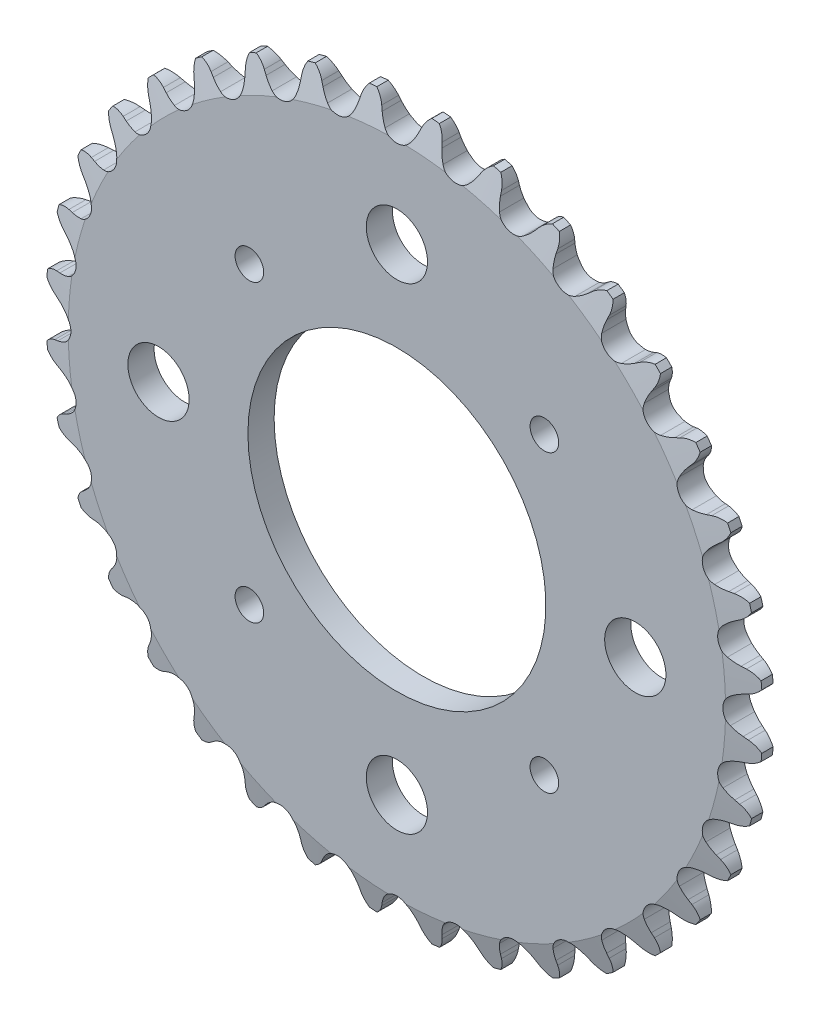
from build123d import *

# Parameters (mm, degrees)
TOOTH_CUT_NUMBER_OF_TEETH_36_DEPTH = 55.034537337
TOOTH_PATTERN_36_36_COUNT          = 36
SKETCH1_R                          = 15.875
SKETCH1_R_2                        = 3.2639
SKETCH1_R_3                        = 1.524
CUT_EXTRUDE1_DEPTH                 = 54.930136832


with BuildPart() as part:
    # Sprocket-BaseSketch → 25 (04C) ANSI (ISO) Chain Number, 2.868in P.D. (revolve)
    with BuildSketch(Plane(origin=(0, 0, 0), x_dir=(0, 0, -1), z_dir=(1, 0, 0))):
        Polygon((1.397, 0), (1.397, 35.020416061), (0.60325, 38.195416061), (-0.60325, 38.195416061), (-1.397, 35.020416061), (-1.397, 0), align=None)
    revolve(axis=Axis((0, 0, -5.588), (0, 0, 1)))

    # Tooth-Sketch → Tooth-Cut, Number of teeth: 36 (cut, symmetric)
    with BuildSketch(Plane.XY):
        with BuildLine():
            Line((1.95260897, 36.506681097), (2.113680484, 36.943937247))
            ThreePointArc((2.113680484, 36.943937247), (3.086471, 38.204095605), (4.60520885, 38.681333297))
            ThreePointArc((4.60520885, 38.681333297), (0, 38.954505442), (-4.60520885, 38.681333297))
            ThreePointArc((-4.60520885, 38.681333297), (-3.086471, 38.204095605), (-2.113680484, 36.943937247))
            Line((-2.113680484, 36.943937247), (-1.95260897, 36.506681097))
            ThreePointArc((-1.95260897, 36.506681097), (-1.696264974, 35.939821607), (-1.361487812, 35.415449434))
            ThreePointArc((-1.361487812, 35.415449434), (0, 34.731684555), (1.361487812, 35.415449434))
            ThreePointArc((1.361487812, 35.415449434), (1.696264974, 35.939821607), (1.95260897, 36.506681097))
        make_face()
    tooth_cut_number_of_teeth_36 = extrude(amount=TOOTH_CUT_NUMBER_OF_TEETH_36_DEPTH, both=True, mode=Mode.SUBTRACT)

    # Tooth Pattern, 36 / 36: Tooth-Cut, Number of teeth: 36 ×36 about axis
    tooth_pattern_36_36_axis = Axis((0, 0, -88.99), (0, 0, 1))
    for i in range(1, TOOTH_PATTERN_36_36_COUNT):
        add(tooth_cut_number_of_teeth_36.rotate(tooth_pattern_36_36_axis, i * 360 / TOOTH_PATTERN_36_36_COUNT), mode=Mode.SUBTRACT)

    # Sketch1 → Cut-Extrude1 (cut, through all)
    with BuildSketch(Plane(origin=(0, 0, -1.397), x_dir=(-1, 0, 0), z_dir=(0, 0, -1))):
        Circle(SKETCH1_R)
        with Locations((0, 25.4)):
            Circle(SKETCH1_R_2)
        with Locations((-15.715448212, 15.715448212)):
            Circle(SKETCH1_R_3)
        with Locations((15.715448212, 15.715448212)):
            Circle(SKETCH1_R_3)
        with Locations((25.4, 0)):
            Circle(SKETCH1_R_2)
        with Locations((15.715448212, -15.715448212)):
            Circle(SKETCH1_R_3)
        with Locations((0, -25.4)):
            Circle(SKETCH1_R_2)
        with Locations((-15.715448212, -15.715448212)):
            Circle(SKETCH1_R_3)
        with Locations((-25.4, 0)):
            Circle(SKETCH1_R_2)
    extrude(amount=-CUT_EXTRUDE1_DEPTH, mode=Mode.SUBTRACT)


solid = part.part
